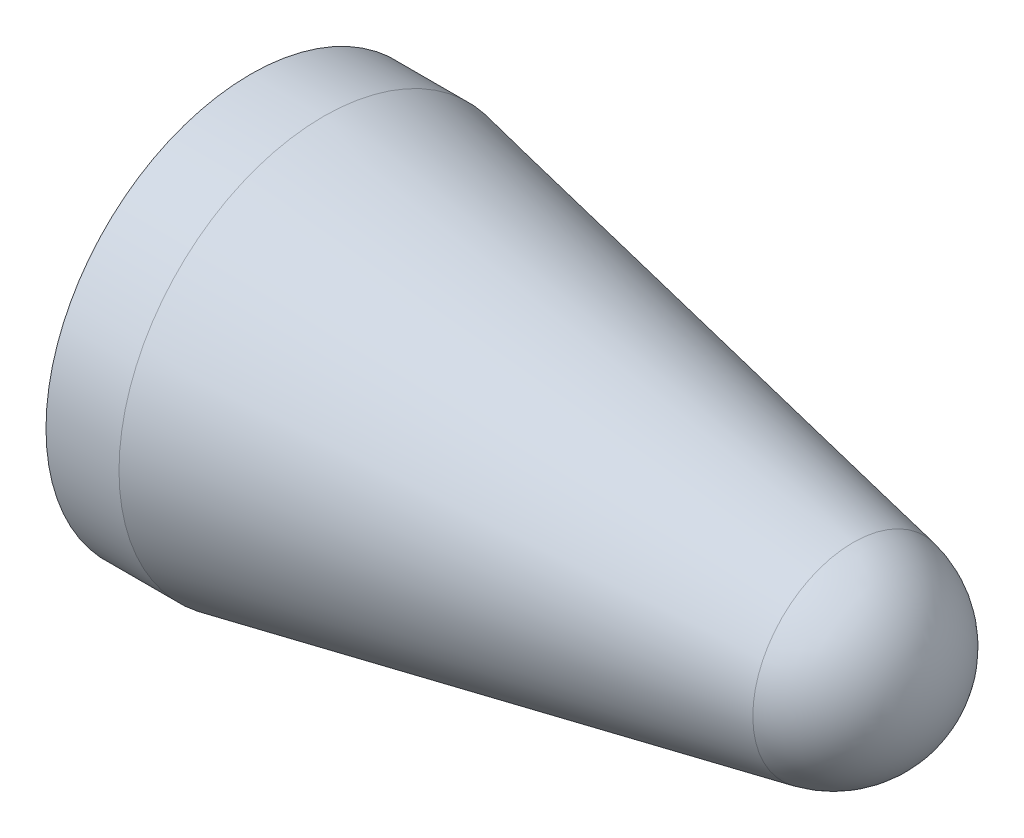
from build123d import *


with BuildPart() as part:
    # Sketch1 → Revolve1 (revolve)
    with BuildSketch(Plane.XY, mode=Mode.PRIVATE) as revolve1_sk:
        with BuildLine():
            Line((-2, 13), (34.158093272, 5.887174193))
            ThreePointArc((34.158093272, 5.887174193), (37.634034939, 3.811262282), (39, 0))
            Line((39, 0), (43, 0))
            ThreePointArc((43, 0), (40.723391565, 6.352103804), (34.930155453, 9.811956988))
            Line((34.930155453, 9.811956988), (-16.860823192, 20))
            Line((-16.860823192, 20), (-24, 20))
            Line((-24, 20), (-24, 16))
            Line((-24, 16), (-17.250518254, 16))
            Line((-17.250518254, 16), (-2, 13))
        make_face()
    revolve(revolve1_sk.sketch.rotate(Axis((39, 0, 0), (1, 0, 0)), 90), axis=Axis((39, 0, 0), (1, 0, 0)))


solid = part.part
